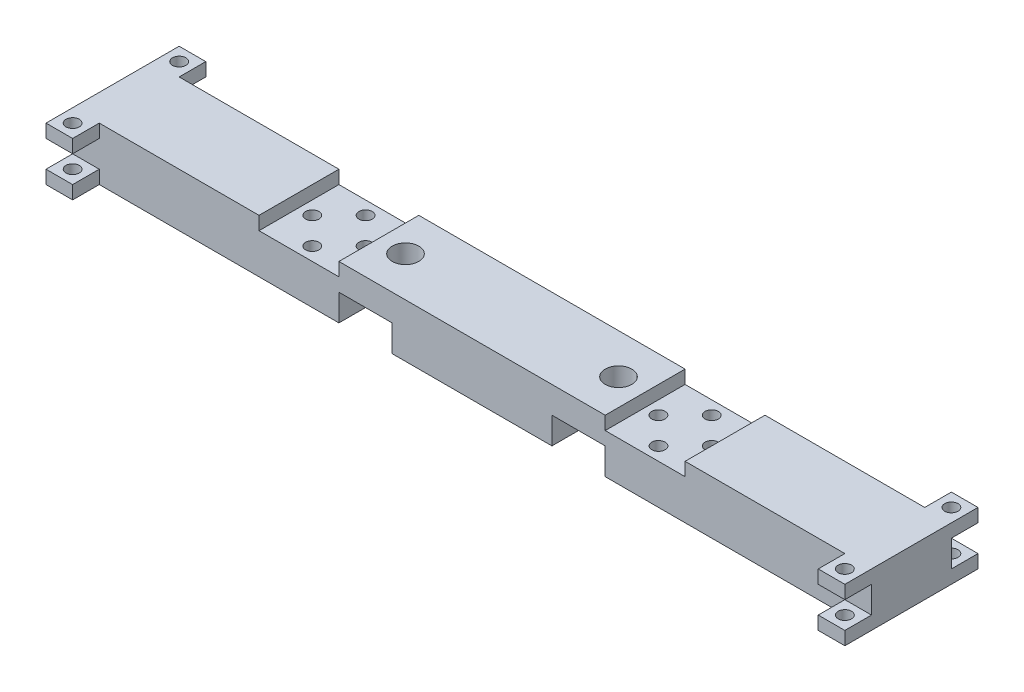
from build123d import *

# Parameters (mm, degrees)
SKETCH1_W           = 300
SKETCH1_H           = 30
SKETCH1_W_2         = 10
SKETCH1_H_2         = 10
BOSS_EXTRUDE1_DEPTH = 20
SKETCH12_W          = 10
SKETCH12_H          = 10
CUT_EXTRUDE5_DEPTH  = 10
SKETCH14_W          = 10
SKETCH14_H          = 10
CUT_EXTRUDE6_DEPTH  = 10
SKETCH3_W           = 20
SKETCH3_H           = 30
CUT_EXTRUDE1_DEPTH  = 10
SKETCH5_R           = 2.5
CUT_EXTRUDE3_DEPTH  = 154.378616502
CUT_EXTRUDE4_REACH  = 154.398
SKETCH7_R           = 5
SKETCH15_W          = 30
SKETCH15_H          = 30
CUT_EXTRUDE7_DEPTH  = 5
SKETCH16_R          = 2.5
CUT_EXTRUDE8_DEPTH  = 5


with BuildPart() as part:
    # Sketch1 → Boss-Extrude1 (new body)
    with BuildSketch(Plane(origin=(0, 0, 0), x_dir=(1, 0, 0), z_dir=(0, 1, 0))):
        Rectangle(SKETCH1_W, SKETCH1_H)
        with Locations((-145, -20)):
            Rectangle(SKETCH1_W_2, SKETCH1_H_2)
        with Locations((-145, 20)):
            Rectangle(SKETCH1_W_2, SKETCH1_H_2)
        with Locations((145, 20)):
            Rectangle(SKETCH1_W_2, SKETCH1_H_2)
        with Locations((145, -20)):
            Rectangle(SKETCH1_W_2, SKETCH1_H_2)
    extrude(amount=-BOSS_EXTRUDE1_DEPTH)

    # Sketch12 → Cut-Extrude5 (cut)
    with BuildSketch(Plane.XY.offset(25)):
        with Locations((-145, -10)):
            Rectangle(SKETCH12_W, SKETCH12_H)
        with Locations((145, -10)):
            Rectangle(SKETCH12_W, SKETCH12_H)
    extrude(amount=-CUT_EXTRUDE5_DEPTH, mode=Mode.SUBTRACT)

    # Sketch14 → Cut-Extrude6 (cut)
    with BuildSketch(Plane(origin=(0, 0, -25), x_dir=(-1, 0, 0), z_dir=(0, 0, -1))):
        with Locations((-145, -10)):
            Rectangle(SKETCH14_W, SKETCH14_H)
        with Locations((145, -10)):
            Rectangle(SKETCH14_W, SKETCH14_H)
    extrude(amount=-CUT_EXTRUDE6_DEPTH, mode=Mode.SUBTRACT)

    # Sketch3 → Cut-Extrude1 (cut)
    with BuildSketch(Plane.XZ.offset(20)):
        with Locations((-40, 0)):
            Rectangle(SKETCH3_W, SKETCH3_H)
        with Locations((40, 0)):
            Rectangle(SKETCH3_W, SKETCH3_H)
    extrude(amount=-CUT_EXTRUDE1_DEPTH, mode=Mode.SUBTRACT)

    # Sketch5 → Cut-Extrude3 (cut, through all)
    with BuildSketch(Plane(origin=(0, 0, 0), x_dir=(1, 0, 0), z_dir=(0, 1, 0))):
        with Locations(Location((145, -20, 0), (0, 0, 270))):
            Circle(SKETCH5_R)
        with Locations(Location((145, 20, 0), (0, 0, 270))):
            Circle(SKETCH5_R)
        with Locations(Location((-145, 20, 0), (0, 0, 270))):
            Circle(SKETCH5_R)
        with Locations(Location((-145, -20, 0), (0, 0, 90))):
            Circle(SKETCH5_R)
    extrude(amount=-CUT_EXTRUDE3_DEPTH, mode=Mode.SUBTRACT)

    # Sketch7 → Cut-Extrude4 (cut, up to next)
    with BuildSketch(Plane.XZ.offset(10), mode=Mode.PRIVATE) as cut_extrude4_sk1:
        with Locations(Location((-40, 0, 0), (0, 0, 270))):
            Circle(SKETCH7_R)
    cut_extrude4_tool1 = extrude(cut_extrude4_sk1.sketch, amount=-CUT_EXTRUDE4_REACH, mode=Mode.PRIVATE) & part.part
    # Sketch7 → Cut-Extrude4 (cut, up to next)
    with BuildSketch(Plane.XZ.offset(10), mode=Mode.PRIVATE) as cut_extrude4_sk2:
        with Locations(Location((40, 0, 0), (0, 0, 90))):
            Circle(SKETCH7_R)
    cut_extrude4_tool2 = extrude(cut_extrude4_sk2.sketch, amount=-CUT_EXTRUDE4_REACH, mode=Mode.PRIVATE) & part.part
    add(cut_extrude4_tool1.solids().sort_by_distance((-40, -10, 0))[0], mode=Mode.SUBTRACT)
    add(cut_extrude4_tool2.solids().sort_by_distance((40, -10, 0))[0], mode=Mode.SUBTRACT)

    # Sketch15 → Cut-Extrude7 (cut)
    with BuildSketch(Plane(origin=(0, 0, 0), x_dir=(1, 0, 0), z_dir=(0, 1, 0))):
        with Locations((-65, 0)):
            Rectangle(SKETCH15_W, SKETCH15_H)
    cut_extrude7 = extrude(amount=-CUT_EXTRUDE7_DEPTH, mode=Mode.SUBTRACT)

    # Mirror1: Cut-Extrude7 across plane
    add(cut_extrude7.mirror(Plane(origin=(0, 0, 0), x_dir=(0, 0, 1), z_dir=(1, 0, 0))), mode=Mode.SUBTRACT)

    # Sketch16 → Cut-Extrude8 (cut)
    with BuildSketch(Plane(origin=(0, -5, 0), x_dir=(1, 0, 0), z_dir=(0, 1, 0))):
        with Locations(Location((-65, 10, 0), (0, 0, 270))):
            Circle(SKETCH16_R)
        with Locations(Location((-75, 0, 0), (0, 0, 270))):
            Circle(SKETCH16_R)
        with Locations(Location((-65, -10, 0), (0, 0, 270))):
            Circle(SKETCH16_R)
        with Locations(Location((-55, 0, 0), (0, 0, 270))):
            Circle(SKETCH16_R)
    cut_extrude8 = extrude(amount=-CUT_EXTRUDE8_DEPTH, mode=Mode.SUBTRACT)

    # Mirror2: Cut-Extrude8 across plane
    add(cut_extrude8.mirror(Plane(origin=(0, 0, 0), x_dir=(0, 0, 1), z_dir=(1, 0, 0))), mode=Mode.SUBTRACT)


solid = part.part
